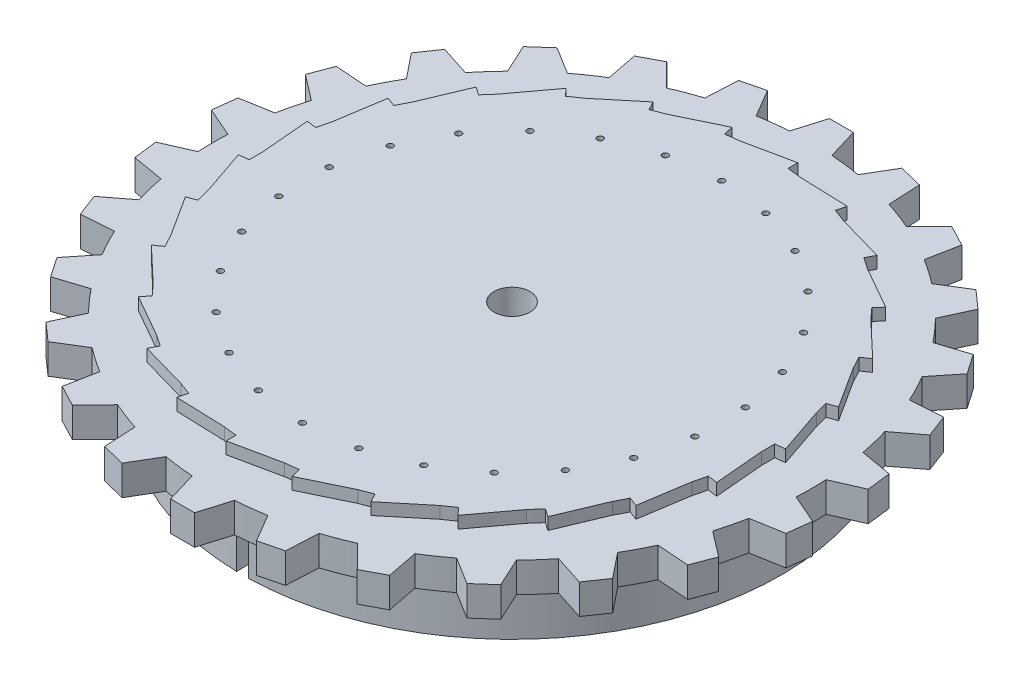
from build123d import *

# Parameters (mm, degrees)
GEAR_EXTRUDE_DEPTH   = 5
CENTER_ROTATOR_DEPTH = 10
BOSS_EXTRUDE3_DEPTH  = 2
SKETCH6_R            = 3
SKETCH6_R_2          = 0.5
CUT_EXTRUDE3_DEPTH   = 80.507435742
BOSS_EXTRUDE4_DEPTH  = 5


with BuildPart() as part:
    # Gear sketch → Gear Extrude (new body)
    with BuildSketch(Plane(origin=(0, 0, 0), x_dir=(1, 0, 0), z_dir=(0, 1, 0))):
        with BuildLine():
            Line((-3.5, 50), (-2, 55))
            Line((-2, 55), (2, 55))
            Line((2, 55), (3.5, 50))
            Line((3.5, 50), (3.537590747, 49.87469751))
            ThreePointArc((3.537590747, 49.87469751), (6.026834013, 49.635443705), (8.501001577, 49.272030323))
            Line((8.501001577, 49.272030323), (11.220477901, 53.880431287))
            Line((11.220477901, 53.880431287), (15.104245171, 52.92316863))
            Line((15.104245171, 52.92316863), (15.364079575, 47.709486046))
            Line((15.364079575, 47.709486046), (15.370591155, 47.578828564))
            ThreePointArc((15.370591155, 47.578828564), (17.730244352, 46.750812134), (20.045546588, 45.805851831))
            Line((20.045546588, 45.805851831), (20.137062512, 45.899332385))
            Line((20.137062512, 45.899332385), (23.788862411, 49.629527755))
            Line((23.788862411, 49.629527755), (27.330686514, 47.770635067))
            Line((27.330686514, 47.770635067), (26.335254692, 42.646270181))
            Line((26.335254692, 42.646270181), (26.310308675, 42.517851044))
            ThreePointArc((26.310308675, 42.517851044), (28.403237337, 41.149193295), (30.425117295, 39.677603728))
            Line((30.425117295, 39.677603728), (30.536345293, 39.746466712))
            Line((30.536345293, 39.746466712), (34.974724707, 42.494336466))
            Line((34.974724707, 42.494336466), (37.9687677, 39.841845833))
            Line((37.9687677, 39.841845833), (35.775920531, 35.104608105))
            Line((35.775920531, 35.104608105), (35.720966689, 34.985890568))
            ThreePointArc((35.720966689, 34.985890568), (37.425537409, 33.156132912), (39.036490775, 31.243437518))
            Line((39.036490775, 31.243437518), (39.160966681, 31.283680867))
            Line((39.160966681, 31.283680867), (44.127983131, 32.889528802))
            Line((44.127983131, 32.889528802), (46.400242118, 29.597593338))
            Line((46.400242118, 29.597593338), (43.137419908, 25.522793806))
            Line((43.137419908, 25.522793806), (43.055651959, 25.4206773))
            ThreePointArc((43.055651959, 25.4206773), (44.272801283, 23.236158602), (45.379205304, 20.993516285))
            Line((45.379205304, 20.993516285), (45.50969503, 21.002801202))
            Line((45.50969503, 21.002801202), (50.716683574, 21.373301273))
            Line((50.716683574, 21.373301273), (52.135103122, 17.633236302))
            Line((52.135103122, 17.633236302), (47.991929239, 14.457687503))
            Line((47.991929239, 14.457687503), (47.888099238, 14.378106668))
            ThreePointArc((47.888099238, 14.378106668), (48.547090871, 11.965783214), (49.084645366, 9.523528194))
            Line((49.084645366, 9.523528194), (49.213565324, 9.501315072))
            Line((49.213565324, 9.501315072), (54.357914715, 8.614935162))
            Line((54.357914715, 8.614935162), (54.840061436, 4.644099666))
            Line((54.840061436, 4.644099666), (50.057322086, 2.552352953))
            Line((50.057322086, 2.552352953), (49.937464256, 2.499932739))
            ThreePointArc((49.937464256, 2.499932739), (50, 0), (49.937464256, -2.499932739))
            Line((49.937464256, -2.499932739), (50.057322086, -2.552352953))
            Line((50.057322086, -2.552352953), (54.840061436, -4.644099666))
            Line((54.840061436, -4.644099666), (54.357914715, -8.614935162))
            Line((54.357914715, -8.614935162), (49.213565324, -9.501315072))
            Line((49.213565324, -9.501315072), (49.084645366, -9.523528194))
            ThreePointArc((49.084645366, -9.523528194), (48.547090871, -11.965783214), (47.888099238, -14.378106668))
            Line((47.888099238, -14.378106668), (47.991929239, -14.457687503))
            Line((47.991929239, -14.457687503), (52.135103122, -17.633236302))
            Line((52.135103122, -17.633236302), (50.716683574, -21.373301273))
            Line((50.716683574, -21.373301273), (45.50969503, -21.002801202))
            Line((45.50969503, -21.002801202), (45.379205304, -20.993516285))
            ThreePointArc((45.379205304, -20.993516285), (44.272801283, -23.236158602), (43.055651959, -25.4206773))
            Line((43.055651959, -25.4206773), (43.137419908, -25.522793806))
            Line((43.137419908, -25.522793806), (46.400242118, -29.597593338))
            Line((46.400242118, -29.597593338), (44.127983131, -32.889528802))
            Line((44.127983131, -32.889528802), (39.160966681, -31.283680867))
            Line((39.160966681, -31.283680867), (39.036490775, -31.243437518))
            ThreePointArc((39.036490775, -31.243437518), (37.425537409, -33.156132912), (35.720966689, -34.985890568))
            Line((35.720966689, -34.985890568), (35.775920531, -35.104608105))
            Line((35.775920531, -35.104608105), (37.9687677, -39.841845833))
            Line((37.9687677, -39.841845833), (34.974724707, -42.494336466))
            Line((34.974724707, -42.494336466), (30.536345293, -39.746466712))
            Line((30.536345293, -39.746466712), (30.425117295, -39.677603728))
            ThreePointArc((30.425117295, -39.677603728), (28.403237337, -41.149193295), (26.310308675, -42.517851044))
            Line((26.310308675, -42.517851044), (26.335254692, -42.646270181))
            Line((26.335254692, -42.646270181), (27.330686514, -47.770635067))
            Line((27.330686514, -47.770635067), (23.788862411, -49.629527755))
            Line((23.788862411, -49.629527755), (20.137062512, -45.899332385))
            Line((20.137062512, -45.899332385), (20.045546588, -45.805851831))
            ThreePointArc((20.045546588, -45.805851831), (17.730244352, -46.750812134), (15.370591155, -47.578828564))
            Line((15.370591155, -47.578828564), (15.364079575, -47.709486046))
            Line((15.364079575, -47.709486046), (15.104245171, -52.92316863))
            Line((15.104245171, -52.92316863), (11.220477901, -53.880431287))
            Line((11.220477901, -53.880431287), (8.567486853, -49.384695696))
            Line((8.567486853, -49.384695696), (8.501001577, -49.272030323))
            ThreePointArc((8.501001577, -49.272030323), (6.026834013, -49.635443705), (3.537590747, -49.87469751))
            Line((3.537590747, -49.87469751), (3.5, -50))
            Line((3.5, -50), (2, -55))
            Line((2, -55), (-2, -55))
            Line((-2, -55), (-3.5, -50))
            Line((-3.5, -50), (-3.537590747, -49.87469751))
            ThreePointArc((-3.537590747, -49.87469751), (-6.026834013, -49.635443705), (-8.501001577, -49.272030323))
            Line((-8.501001577, -49.272030323), (-8.567486853, -49.384695696))
            Line((-8.567486853, -49.384695696), (-11.220477901, -53.880431287))
            Line((-11.220477901, -53.880431287), (-15.104245171, -52.92316863))
            Line((-15.104245171, -52.92316863), (-15.364079575, -47.709486046))
            Line((-15.364079575, -47.709486046), (-15.370591155, -47.578828564))
            ThreePointArc((-15.370591155, -47.578828564), (-17.730244352, -46.750812134), (-20.045546588, -45.805851831))
            Line((-20.045546588, -45.805851831), (-20.137062512, -45.899332385))
            Line((-20.137062512, -45.899332385), (-23.788862411, -49.629527755))
            Line((-23.788862411, -49.629527755), (-27.330686514, -47.770635067))
            Line((-27.330686514, -47.770635067), (-26.335254692, -42.646270181))
            Line((-26.335254692, -42.646270181), (-26.310308675, -42.517851044))
            ThreePointArc((-26.310308675, -42.517851044), (-28.403237337, -41.149193295), (-30.425117295, -39.677603728))
            Line((-30.425117295, -39.677603728), (-30.536345293, -39.746466712))
            Line((-30.536345293, -39.746466712), (-34.974724707, -42.494336466))
            Line((-34.974724707, -42.494336466), (-37.9687677, -39.841845833))
            Line((-37.9687677, -39.841845833), (-35.775920531, -35.104608105))
            Line((-35.775920531, -35.104608105), (-35.720966689, -34.985890568))
            ThreePointArc((-35.720966689, -34.985890568), (-37.425537409, -33.156132912), (-39.036490775, -31.243437518))
            Line((-39.036490775, -31.243437518), (-39.160966681, -31.283680867))
            Line((-39.160966681, -31.283680867), (-44.127983131, -32.889528802))
            Line((-44.127983131, -32.889528802), (-46.400242118, -29.597593338))
            Line((-46.400242118, -29.597593338), (-43.137419908, -25.522793806))
            Line((-43.137419908, -25.522793806), (-43.055651959, -25.4206773))
            ThreePointArc((-43.055651959, -25.4206773), (-44.272801283, -23.236158602), (-45.379205304, -20.993516285))
            Line((-45.379205304, -20.993516285), (-45.50969503, -21.002801202))
            Line((-45.50969503, -21.002801202), (-50.716683574, -21.373301273))
            Line((-50.716683574, -21.373301273), (-52.135103122, -17.633236302))
            Line((-52.135103122, -17.633236302), (-47.991929239, -14.457687503))
            Line((-47.991929239, -14.457687503), (-47.888099238, -14.378106668))
            ThreePointArc((-47.888099238, -14.378106668), (-48.547090871, -11.965783214), (-49.084645366, -9.523528194))
            Line((-49.084645366, -9.523528194), (-49.213565324, -9.501315072))
            Line((-49.213565324, -9.501315072), (-54.357914715, -8.614935162))
            Line((-54.357914715, -8.614935162), (-54.840061436, -4.644099666))
            Line((-54.840061436, -4.644099666), (-50.057322086, -2.552352953))
            Line((-50.057322086, -2.552352953), (-49.937464256, -2.499932739))
            ThreePointArc((-49.937464256, -2.499932739), (-50, 0), (-49.937464256, 2.499932739))
            Line((-49.937464256, 2.499932739), (-50.057322086, 2.552352953))
            Line((-50.057322086, 2.552352953), (-54.840061436, 4.644099666))
            Line((-54.840061436, 4.644099666), (-54.357914715, 8.614935162))
            Line((-54.357914715, 8.614935162), (-49.213565324, 9.501315072))
            Line((-49.213565324, 9.501315072), (-49.084645366, 9.523528194))
            ThreePointArc((-49.084645366, 9.523528194), (-48.547090871, 11.965783214), (-47.888099238, 14.378106668))
            Line((-47.888099238, 14.378106668), (-47.991929239, 14.457687503))
            Line((-47.991929239, 14.457687503), (-52.135103122, 17.633236302))
            Line((-52.135103122, 17.633236302), (-50.716683574, 21.373301273))
            Line((-50.716683574, 21.373301273), (-45.50969503, 21.002801202))
            Line((-45.50969503, 21.002801202), (-45.379205304, 20.993516285))
            ThreePointArc((-45.379205304, 20.993516285), (-44.272801283, 23.236158602), (-43.055651959, 25.4206773))
            Line((-43.055651959, 25.4206773), (-43.137419908, 25.522793806))
            Line((-43.137419908, 25.522793806), (-46.400242118, 29.597593338))
            Line((-46.400242118, 29.597593338), (-44.127983131, 32.889528802))
            Line((-44.127983131, 32.889528802), (-39.160966681, 31.283680867))
            Line((-39.160966681, 31.283680867), (-39.036490775, 31.243437518))
            ThreePointArc((-39.036490775, 31.243437518), (-37.425537409, 33.156132912), (-35.720966689, 34.985890568))
            Line((-35.720966689, 34.985890568), (-35.775920531, 35.104608105))
            Line((-35.775920531, 35.104608105), (-37.9687677, 39.841845833))
            Line((-37.9687677, 39.841845833), (-34.974724707, 42.494336466))
            Line((-34.974724707, 42.494336466), (-30.536345293, 39.746466712))
            Line((-30.536345293, 39.746466712), (-30.425117295, 39.677603728))
            ThreePointArc((-30.425117295, 39.677603728), (-28.403237337, 41.149193295), (-26.310308675, 42.517851044))
            Line((-26.310308675, 42.517851044), (-26.335254692, 42.646270181))
            Line((-26.335254692, 42.646270181), (-27.330686514, 47.770635067))
            Line((-27.330686514, 47.770635067), (-23.788862411, 49.629527755))
            Line((-23.788862411, 49.629527755), (-20.137062512, 45.899332385))
            Line((-20.137062512, 45.899332385), (-20.045546588, 45.805851831))
            ThreePointArc((-20.045546588, 45.805851831), (-17.730244352, 46.750812134), (-15.370591155, 47.578828564))
            Line((-15.370591155, 47.578828564), (-15.364079575, 47.709486046))
            Line((-15.364079575, 47.709486046), (-15.104245171, 52.92316863))
            Line((-15.104245171, 52.92316863), (-11.220477901, 53.880431287))
            Line((-11.220477901, 53.880431287), (-8.567486853, 49.384695696))
            Line((-8.567486853, 49.384695696), (-8.501001577, 49.272030323))
            ThreePointArc((-8.501001577, 49.272030323), (-6.026834013, 49.635443705), (-3.537590747, 49.87469751))
            Line((-3.537590747, 49.87469751), (-3.5, 50))
        make_face()
    extrude(amount=GEAR_EXTRUDE_DEPTH)

    # Center hole sketch → Center rotator (add)
    with BuildSketch(Plane(origin=(0, 0, 0), x_dir=(-1, 0, 0), z_dir=(0, -1, 0))):
        with BuildLine():
            Line((1, -44.988887517), (1.01597454, -42.987995949))
            ThreePointArc((1.01597454, -42.987995949), (-0.015978861, 42.999997031), (-0.98402546, -42.988739152))
            Line((-0.98402546, -42.988739152), (-1, -44.988887517))
            ThreePointArc((-1, -44.988887517), (0, 45), (1, -44.988887517))
        make_face()
    extrude(amount=CENTER_ROTATOR_DEPTH)

    # Sketch7 → Boss-Extrude3 (add)
    with BuildSketch(Plane.XZ.offset(-5)):
        with BuildLine():
            Line((-3.748189409, 43.975290473), (4.300617977, 42.281848174))
            ThreePointArc((4.300617977, 42.281848174), (5.398137808, 42.155783805), (6.49201024, 42.001235732))
            Line((6.49201024, 42.001235732), (6.884702015, 43.594448892))
            Line((6.884702015, 43.594448892), (14.294358418, 40.024009262))
            ThreePointArc((14.294358418, 40.024009262), (15.329817139, 39.638954407), (16.354917852, 39.227116413))
            Line((16.354917852, 39.227116413), (17.117479583, 40.680056401))
            Line((17.117479583, 40.680056401), (23.457362705, 35.440120413))
            ThreePointArc((23.457362705, 35.440120413), (24.370583219, 34.818453061), (25.267337085, 34.173259672))
            Line((25.267337085, 34.173259672), (26.355451457, 35.401486898))
            Line((26.355451457, 35.401486898), (31.257110336, 28.796580586))
            ThreePointArc((31.257110336, 28.796580586), (31.995019586, 27.974429783), (32.71131053, 27.133377294))
            Line((32.71131053, 27.133377294), (34.061740291, 28.065511655))
            Line((34.061740291, 28.065511655), (37.240308329, 20.479488166))
            ThreePointArc((37.240308329, 20.479488166), (37.760021712, 19.504634328), (38.254221508, 18.516601654))
            Line((38.254221508, 18.516601654), (39.788484588, 19.098470889))
            Line((39.788484588, 19.098470889), (41.059234966, 10.972202333))
            ThreePointArc((41.059234966, 10.972202333), (41.330548628, 9.901300423), (41.57393618, 8.82370843))
            Line((41.57393618, 8.82370843), (43.202866786, 9.021496415))
            Line((43.202866786, 9.021496415), (42.49194811, 0.827251984))
            ThreePointArc((42.49194811, 0.827251984), (42.499094289, -0.277461072), (42.477524797, -1.381986654))
            Line((42.477524797, -1.381986654), (44.106455402, -1.579774639))
            Line((44.106455402, -1.579774639), (41.455183682, -9.365775244))
            ThreePointArc((41.455183682, -9.365775244), (41.197747067, -10.440097539), (40.912474072, -11.507365698))
            Line((40.912474072, -11.507365698), (42.446737151, -12.089234933))
            Line((42.446737151, -12.089234933), (38.009194661, -19.014497658))
            ThreePointArc((38.009194661, -19.014497658), (37.502136533, -19.995993485), (36.969739065, -20.963978475))
            Line((36.969739065, -20.963978475), (38.320168825, -21.896112836))
            Line((38.320168825, -21.896112836), (32.354249405, -27.558166583))
            ThreePointArc((32.354249405, -27.558166583), (31.627038139, -28.389794972), (30.878457202, -29.202241024))
            Line((30.878457202, -29.202241024), (31.966571574, -30.430468249))
            Line((31.966571574, -30.430468249), (24.818992777, -34.500255036))
            ThreePointArc((24.818992777, -34.500255036), (23.913891247, -35.133684768), (22.992631646, -35.74337547))
            Line((22.992631646, -35.74337547), (23.755193378, -37.196315458))
            Line((23.755193378, -37.196315458), (15.841346501, -39.43731407))
            ThreePointArc((15.841346501, -39.43731407), (14.81095592, -39.835732512), (13.770557913, -40.207234856))
            Line((13.770557913, -40.207234856), (14.163249688, -41.800448016))
            Line((14.163249688, -41.800448016), (5.943058748, -42.082419758))
            ThreePointArc((5.943058748, -42.082419758), (4.847261671, -42.222672278), (3.748189409, -42.334395899))
            Line((3.748189409, -42.334395899), (3.748189409, -43.975290473))
            Line((3.748189409, -43.975290473), (-4.300617977, -42.281848174))
            ThreePointArc((-4.300617977, -42.281848174), (-5.398137808, -42.155783805), (-6.49201024, -42.001235732))
            Line((-6.49201024, -42.001235732), (-6.884702015, -43.594448892))
            Line((-6.884702015, -43.594448892), (-14.294358418, -40.024009262))
            ThreePointArc((-14.294358418, -40.024009262), (-15.329817139, -39.638954407), (-16.354917852, -39.227116413))
            Line((-16.354917852, -39.227116413), (-17.117479583, -40.680056401))
            Line((-17.117479583, -40.680056401), (-23.457362705, -35.440120413))
            ThreePointArc((-23.457362705, -35.440120413), (-24.370583219, -34.818453061), (-25.267337085, -34.173259672))
            Line((-25.267337085, -34.173259672), (-26.355451457, -35.401486898))
            Line((-26.355451457, -35.401486898), (-31.257110336, -28.796580586))
            ThreePointArc((-31.257110336, -28.796580586), (-31.995019586, -27.974429783), (-32.71131053, -27.133377294))
            Line((-32.71131053, -27.133377294), (-34.061740291, -28.065511655))
            Line((-34.061740291, -28.065511655), (-37.240308329, -20.479488166))
            ThreePointArc((-37.240308329, -20.479488166), (-37.760021712, -19.504634328), (-38.254221508, -18.516601654))
            Line((-38.254221508, -18.516601654), (-39.788484588, -19.098470889))
            Line((-39.788484588, -19.098470889), (-41.059234966, -10.972202333))
            ThreePointArc((-41.059234966, -10.972202333), (-41.330548628, -9.901300423), (-41.57393618, -8.82370843))
            Line((-41.57393618, -8.82370843), (-43.202866786, -9.021496415))
            Line((-43.202866786, -9.021496415), (-42.49194811, -0.827251984))
            ThreePointArc((-42.49194811, -0.827251984), (-42.499094289, 0.277461072), (-42.477524797, 1.381986654))
            Line((-42.477524797, 1.381986654), (-44.106455402, 1.579774639))
            Line((-44.106455402, 1.579774639), (-41.455183682, 9.365775244))
            ThreePointArc((-41.455183682, 9.365775244), (-41.197747067, 10.440097539), (-40.912474072, 11.507365698))
            Line((-40.912474072, 11.507365698), (-42.446737151, 12.089234933))
            Line((-42.446737151, 12.089234933), (-38.009194661, 19.014497658))
            ThreePointArc((-38.009194661, 19.014497658), (-37.502136533, 19.995993485), (-36.969739065, 20.963978475))
            Line((-36.969739065, 20.963978475), (-38.320168825, 21.896112836))
            Line((-38.320168825, 21.896112836), (-32.354249405, 27.558166583))
            ThreePointArc((-32.354249405, 27.558166583), (-31.627038139, 28.389794972), (-30.878457202, 29.202241024))
            Line((-30.878457202, 29.202241024), (-31.966571574, 30.430468249))
            Line((-31.966571574, 30.430468249), (-24.818992777, 34.500255036))
            ThreePointArc((-24.818992777, 34.500255036), (-23.913891247, 35.133684768), (-22.992631646, 35.74337547))
            Line((-22.992631646, 35.74337547), (-23.755193378, 37.196315458))
            Line((-23.755193378, 37.196315458), (-15.841346501, 39.43731407))
            ThreePointArc((-15.841346501, 39.43731407), (-14.81095592, 39.835732512), (-13.770557913, 40.207234856))
            Line((-13.770557913, 40.207234856), (-14.163249688, 41.800448016))
            Line((-14.163249688, 41.800448016), (-5.943058748, 42.082419758))
            ThreePointArc((-5.943058748, 42.082419758), (-4.847261671, 42.222672278), (-3.748189409, 42.334395899))
            Line((-3.748189409, 42.334395899), (-3.748189409, 43.975290473))
        make_face()
    extrude(amount=-BOSS_EXTRUDE3_DEPTH)

    # Sketch6 → Cut-Extrude3 (cut, through all)
    with BuildSketch(Plane.XZ.offset(-7)):
        with Locations(Location((0, 0, 0), (0, 0, 90))):
            Circle(SKETCH6_R)
        with Locations(Location((0, -35, 0), (0, 0, 90))):
            Circle(SKETCH6_R_2)
        with Locations(Location((-8.37604825, -33.98296361, 0), (0, 0, 90))):
            Circle(SKETCH6_R_2)
        with Locations(Location((-16.265311022, -30.990960898, 0), (0, 0, 90))):
            Circle(SKETCH6_R_2)
        with Locations(Location((-23.209293038, -26.197876186, 0), (0, 0, 90))):
            Circle(SKETCH6_R_2)
        with Locations(Location((-28.804435306, -19.882266136, 0), (0, 0, 90))):
            Circle(SKETCH6_R_2)
        with Locations(Location((-32.725568494, -12.411171046, 0), (0, 0, 90))):
            Circle(SKETCH6_R_2)
        with Locations(Location((-34.744810593, -4.218783809, 0), (0, 0, 90))):
            Circle(SKETCH6_R_2)
        with Locations(Location((-34.744810593, 4.218783809, 0), (0, 0, 90))):
            Circle(SKETCH6_R_2)
        with Locations(Location((-32.725568494, 12.411171046, 0), (0, 0, 90))):
            Circle(SKETCH6_R_2)
        with Locations(Location((-28.804435306, 19.882266136, 0), (0, 0, 90))):
            Circle(SKETCH6_R_2)
        with Locations(Location((-23.209293038, 26.197876186, 0), (0, 0, 90))):
            Circle(SKETCH6_R_2)
        with Locations(Location((-16.265311022, 30.990960898, 0), (0, 0, 90))):
            Circle(SKETCH6_R_2)
        with Locations(Location((-8.37604825, 33.98296361, 0), (0, 0, 90))):
            Circle(SKETCH6_R_2)
        with Locations(Location((0, 35, 0), (0, 0, 90))):
            Circle(SKETCH6_R_2)
        with Locations(Location((8.37604825, 33.98296361, 0), (0, 0, 90))):
            Circle(SKETCH6_R_2)
        with Locations(Location((16.265311022, 30.990960898, 0), (0, 0, 90))):
            Circle(SKETCH6_R_2)
        with Locations(Location((23.209293038, 26.197876186, 0), (0, 0, 90))):
            Circle(SKETCH6_R_2)
        with Locations(Location((28.804435306, 19.882266136, 0), (0, 0, 90))):
            Circle(SKETCH6_R_2)
        with Locations(Location((32.725568494, 12.411171046, 0), (0, 0, 90))):
            Circle(SKETCH6_R_2)
        with Locations(Location((34.744810593, 4.218783809, 0), (0, 0, 90))):
            Circle(SKETCH6_R_2)
        with Locations(Location((34.744810593, -4.218783809, 0), (0, 0, 90))):
            Circle(SKETCH6_R_2)
        with Locations(Location((32.725568494, -12.411171046, 0), (0, 0, 90))):
            Circle(SKETCH6_R_2)
        with Locations(Location((28.804435306, -19.882266136, 0), (0, 0, 90))):
            Circle(SKETCH6_R_2)
        with Locations(Location((23.209293038, -26.197876186, 0), (0, 0, 90))):
            Circle(SKETCH6_R_2)
        with Locations(Location((16.265311022, -30.990960898, 0), (0, 0, 90))):
            Circle(SKETCH6_R_2)
        with Locations(Location((8.37604825, -33.98296361, 0), (0, 0, 90))):
            Circle(SKETCH6_R_2)
    extrude(amount=CUT_EXTRUDE3_DEPTH, mode=Mode.SUBTRACT)

    # Sketch8 → Boss-Extrude4 (add)
    with BuildSketch(Plane.XZ):
        Polygon((2, -55), (3.537590747, -49.87469751), (-3.537590747, -49.87469751), (-2, -55), align=None)
    extrude(amount=BOSS_EXTRUDE4_DEPTH)


solid = part.part
